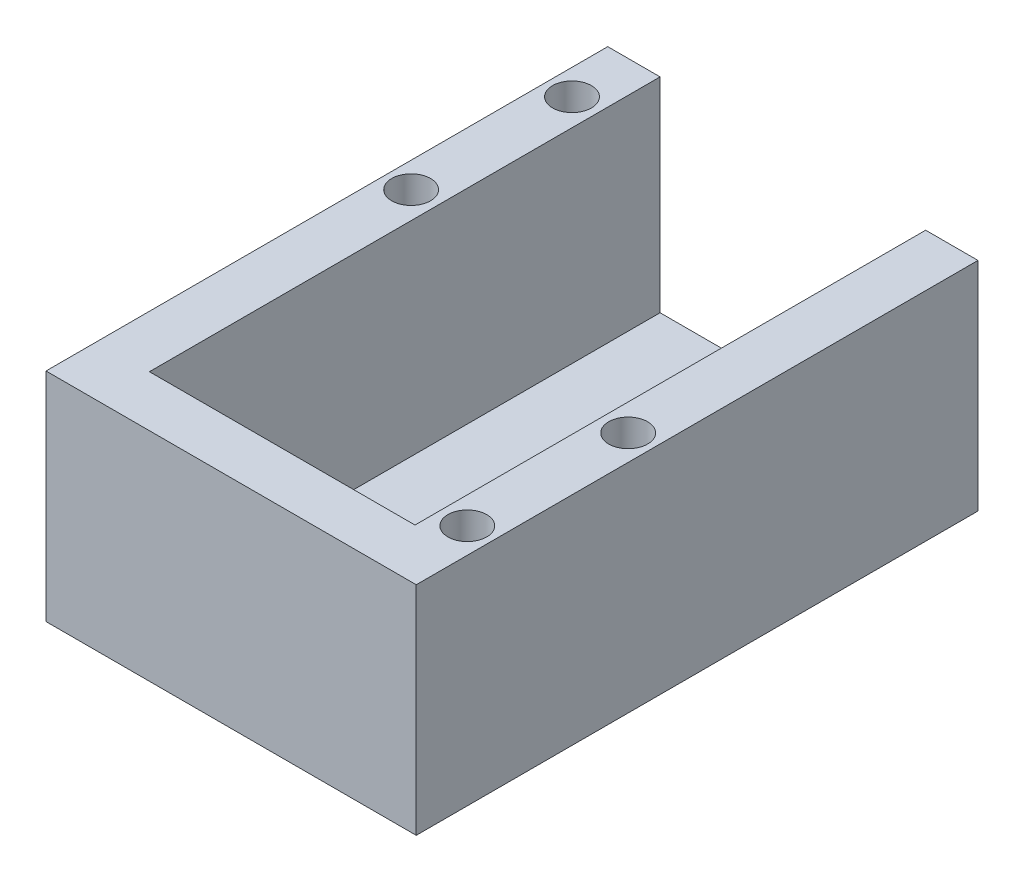
from build123d import *

# Parameters (mm, degrees)
SKETCH1_W                   = 36.83
SKETCH1_H                   = 55.88
BOSS_EXTRUDE1_DEPTH         = 21.59
SKETCH3_W                   = 26.416
SKETCH3_H                   = 20.32
CUT_EXTRUDE1_DEPTH          = 50.8
F_1_0_MM_DOWEL_HOLES1_D     = 3.8608
F_1_0_MM_DOWEL_HOLES1_DEPTH = 5.08
F_1_0_MM_DOWEL_HOLES1_TIP   = 1.159901339


with BuildPart() as part:
    # Sketch1 → Boss-Extrude1 (new body)
    with BuildSketch(Plane(origin=(0, 0, 0), x_dir=(1, 0, 0), z_dir=(0, 1, 0))):
        with Locations((0, 27.94)):
            Rectangle(SKETCH1_W, SKETCH1_H)
    extrude(amount=BOSS_EXTRUDE1_DEPTH)

    # Sketch3 → Cut-Extrude1 (cut)
    with BuildSketch(Plane(origin=(0, 0, -55.88), x_dir=(-1, 0, 0), z_dir=(0, 0, -1))):
        with Locations((0, 11.43)):
            Rectangle(SKETCH3_W, SKETCH3_H)
    extrude(amount=-CUT_EXTRUDE1_DEPTH, mode=Mode.SUBTRACT)

    # Ø1.0 mm Dowel Holes1
    with Locations(Plane(origin=(0, 21.59, 0), x_dir=(1, 0, 0), z_dir=(0, 1, 0))):
        with Locations((15.875, 7.62), (15.875, 23.622), (-15.875, 33.782), (-15.875, 49.784)):
            Hole(F_1_0_MM_DOWEL_HOLES1_D / 2, depth=F_1_0_MM_DOWEL_HOLES1_DEPTH)
            with Locations((0, 0, -(F_1_0_MM_DOWEL_HOLES1_DEPTH + F_1_0_MM_DOWEL_HOLES1_TIP / 2))):  # 118° drill point
                Cone(0, F_1_0_MM_DOWEL_HOLES1_D / 2, F_1_0_MM_DOWEL_HOLES1_TIP, mode=Mode.SUBTRACT)


solid = part.part
